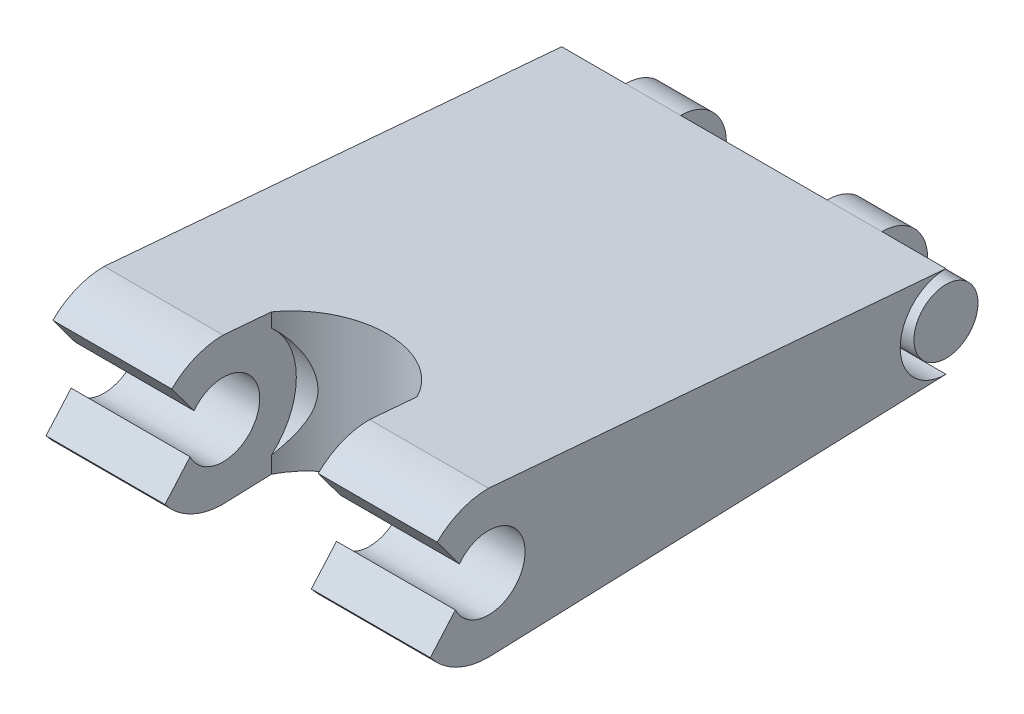
from build123d import *

# Parameters (mm, degrees)
SKETCH1_R           = 4
SKETCH1_R_2         = 5
SKETCH1_R_3         = 3.5
BOSS_EXTRUDE1_DEPTH = 21
SKETCH1_4_R         = 4
CUT_EXTRUDE2_DEPTH  = 8
SKETCH1_5_R         = 5
SKETCH1_5_R_2       = 3.5
CUT_EXTRUDE3_DEPTH  = 8
CUT_EXTRUDE4_START  = 21
SKETCH1_6_R         = 5
SKETCH1_6_R_2       = 3.5
CUT_EXTRUDE4_DEPTH  = 7
CUT_EXTRUDE5_DEPTH  = 10
CUT_EXTRUDE6_REACH  = 71.663


with BuildPart() as part:
    # Sketch1 → Boss-Extrude1 (new, symmetric)
    # profile 1 of 4: a face of its own
    with BuildSketch(Plane(origin=(0, 0, 0), x_dir=(0, 0, -1), z_dir=(1, 0, 0))):
        with BuildLine():
            Line((50, 3.790245356), (1.337639211, 7.887377342))
            ThreePointArc((1.337639211, 7.887377342), (6.111510193, 5.162309866), (8, 0))
            ThreePointArc((8, 0), (5.855645149, -5.450818277), (0.572145029, -7.9795144))
            Line((0.572145029, -7.9795144), (50, -6.209754644))
            ThreePointArc((50, -6.209754644), (45, -1.209754644), (50, 3.790245356))
        make_face()
    # profile 2 of 4: a face of its own
    with BuildSketch(Plane(origin=(0, 0, 0), x_dir=(0, 0, -1), z_dir=(1, 0, 0))):
        with BuildLine():
            Line((1.337639211, 7.887377342), (0, 8))
            ThreePointArc((0, 8), (-8, 0), (0, -8))
            Line((0, -8), (0.572145029, -7.9795144))
            ThreePointArc((0.572145029, -7.9795144), (5.855645149, -5.450818277), (8, 0))
            ThreePointArc((8, 0), (6.111510193, 5.162309866), (1.337639211, 7.887377342))
        make_face()
        with Locations(Location((0, 0, 0), (0, 0, 180))):
            Circle(SKETCH1_R, mode=Mode.SUBTRACT)
    # profile 3 of 4: a face of its own
    with BuildSketch(Plane(origin=(0, 0, 0), x_dir=(0, 0, -1), z_dir=(1, 0, 0))):
        with Locations((50, -1.209754644)):
            Circle(SKETCH1_R_2)
        with Locations((50, -1.209754644)):
            Circle(SKETCH1_R_3, mode=Mode.SUBTRACT)
    # profile 4 of 4: a face of its own
    with BuildSketch(Plane(origin=(0, 0, 0), x_dir=(0, 0, -1), z_dir=(1, 0, 0))):
        with Locations((50, -1.209754644)):
            Circle(SKETCH1_R_3)
    extrude(amount=BOSS_EXTRUDE1_DEPTH, both=True)

    # Sketch1<4> → Cut-Extrude2 (cut, symmetric)
    with BuildSketch(Plane(origin=(0, 0, 0), x_dir=(0, 0, -1), z_dir=(1, 0, 0))):
        with BuildLine():
            Line((1.337639211, 7.887377342), (0, 8))
            ThreePointArc((0, 8), (-8, 0), (0, -8))
            Line((0, -8), (0.572145029, -7.9795144))
            ThreePointArc((0.572145029, -7.9795144), (5.855645149, -5.450818277), (8, 0))
            ThreePointArc((8, 0), (6.111510193, 5.162309866), (1.337639211, 7.887377342))
        make_face()
        with Locations(Location((0, 0, 0), (0, 0, 180))):
            Circle(SKETCH1_4_R, mode=Mode.SUBTRACT)
    extrude(amount=CUT_EXTRUDE2_DEPTH, both=True, mode=Mode.SUBTRACT)

    # Sketch1<5> → Cut-Extrude3 (cut, symmetric)
    with BuildSketch(Plane(origin=(0, 0, 0), x_dir=(0, 0, -1), z_dir=(1, 0, 0))):
        with Locations((50, -1.209754644)):
            Circle(SKETCH1_5_R)
        with Locations((50, -1.209754644)):
            Circle(SKETCH1_5_R_2, mode=Mode.SUBTRACT)
    extrude(amount=CUT_EXTRUDE3_DEPTH, both=True, mode=Mode.SUBTRACT)

    # Sketch1<6> → Cut-Extrude4 (cut)
    with BuildSketch(Plane(origin=(0, 0, 0), x_dir=(0, 0, -1), z_dir=(1, 0, 0)).offset(CUT_EXTRUDE4_START)):
        with Locations((50, -1.209754644)):
            Circle(SKETCH1_6_R)
        with Locations((50, -1.209754644)):
            Circle(SKETCH1_6_R_2, mode=Mode.SUBTRACT)
    cut_extrude4 = extrude(amount=-CUT_EXTRUDE4_DEPTH, mode=Mode.SUBTRACT)

    # Mirror1: Cut-Extrude4 across plane
    add(cut_extrude4.mirror(Plane(origin=(0, 0, 0), x_dir=(0, 0, 1), z_dir=(1, 0, 0))), mode=Mode.SUBTRACT)

    # Sketch3 → Cut-Extrude5 (cut, symmetric)
    with BuildSketch(Plane(origin=(0, 0, 0), x_dir=(1, 0, 0), z_dir=(0, 1, 0))):
        with BuildLine():
            Line((-8, 5.272211447), (-8, -3.420978971))
            Line((-8, -3.420978971), (8, -3.420978971))
            Line((8, -3.420978971), (8, 5.208098852))
            ThreePointArc((8, 5.208098852), (0.018739109, 9.916704947), (-8, 5.272211447))
        make_face()
    extrude(amount=CUT_EXTRUDE5_DEPTH, both=True, mode=Mode.SUBTRACT)

    # Cut-Extrude6: up to this face of the body (flat: up to its plane)
    cut_extrude6_end = Plane(part.part.faces().sort_by_distance((-21, -0.477188429, -19.332209002))[0])
    # Sketch4 → Cut-Extrude6 (cut, up to the picked face)
    with BuildSketch(Plane(origin=(21, 0, 0), x_dir=(0, 0, -1), z_dir=(1, 0, 0)), mode=Mode.PRIVATE) as cut_extrude6_sk1:
        with BuildLine():
            Line((-5.612672438, 5.700693652), (-3.179432131, 2.427181766))
            ThreePointArc((-3.179432131, 2.427181766), (-3.978246032, 0.416603538), (-3.613291572, -1.715844985))
            Line((-3.613291572, -1.715844985), (-6.359318362, -4.853768636))
            ThreePointArc((-6.359318362, -4.853768636), (-7.980056984, 0.564526819), (-5.612672438, 5.700693652))
        make_face()
    cut_extrude6_tool1 = split(extrude(cut_extrude6_sk1.sketch, amount=-CUT_EXTRUDE6_REACH, mode=Mode.PRIVATE), bisect_by=cut_extrude6_end, keep=Keep.BOTH, mode=Mode.PRIVATE)
    add(cut_extrude6_tool1.solids().sort_by(Axis((21, 0.46282, 5.810666), (-1, 0, 0)))[0], mode=Mode.SUBTRACT)


solid = part.part
